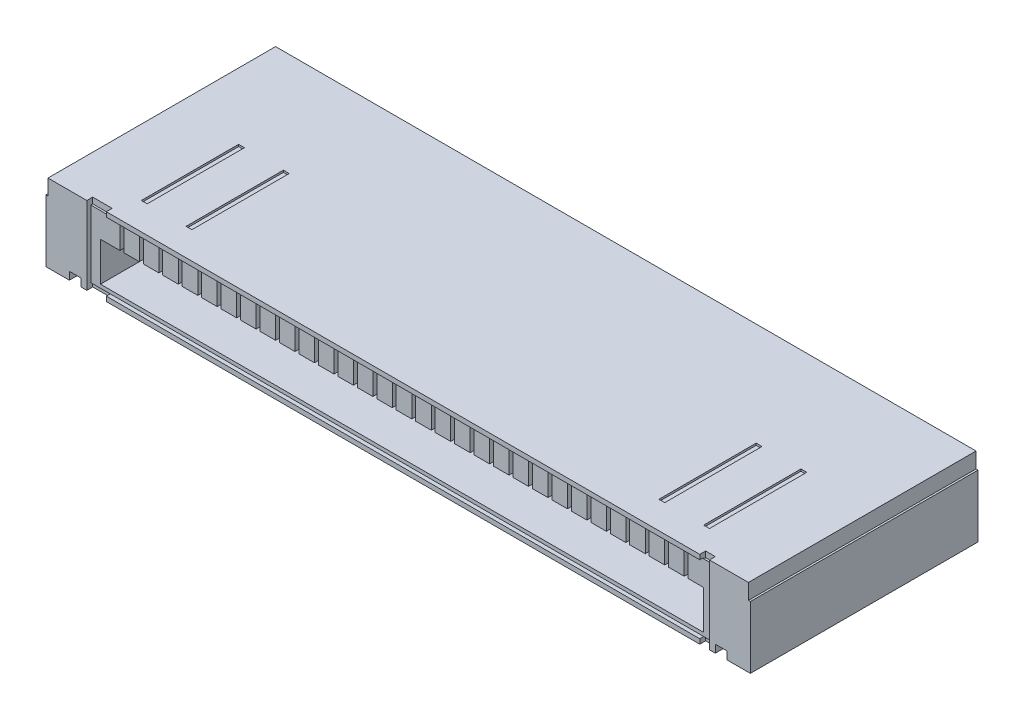
from build123d import *

# Parameters (mm, degrees)
BOSS_EXTRU_1_DEPTH       = 9
ENL_V_MAT_EXTRU_1_DEPTH  = 0.15
BOSS_EXTRU_2_DEPTH       = 6
CONG_1_R                 = 0.3
CONG_2_R                 = 0.3
ESQUISSE5_W              = 0.15
ESQUISSE5_H              = 2.5
ENL_V_MAT_EXTRU_2_DEPTH  = 0.05
ESQUISSE6_W              = 16
ESQUISSE6_H              = 1.75692954
ENL_V_MAT_EXTRU_3_DEPTH  = 0.1
ESQUISSE7_W              = 15.5
ESQUISSE7_H              = 1
ENL_V_MAT_EXTRU_4_DEPTH  = 4
ESQUISSE9_W              = 0.1
ESQUISSE9_H              = 0.66610296
ENL_V_MAT_EXTRU_5_DEPTH  = 0.1
ESQUISSE10_W             = 0.1
ESQUISSE10_H             = 3.9
ENL_V_MAT_EXTRU_6_DEPTH  = 0.1
ESQUISSE20_W             = 0.5
ESQUISSE20_H             = 0.15
ESQUISSE20_W_2           = 0.25
ENL_V_MAT_EXTRU_13_DEPTH = 0.15
ESQUISSE21_W             = 0.15
ESQUISSE21_H             = 2.5
ENL_V_MAT_EXTRU_14_DEPTH = 0.05
ESQUISSE22_W             = 0.3
ESQUISSE22_H             = 3
ENL_V_MAT_EXTRU_15_DEPTH = 0.2
SKETCH1_W                = 28.41764625
SKETCH1_H                = 6.211992325
CUT_EXTRUDE1_DEPTH       = 9
SKETCH2_W                = 0.5
SKETCH2_H                = 0.15
SKETCH2_W_2              = 0.25
CUT_EXTRUDE2_DEPTH       = 0.12154
CUT_EXTRUDE5_DEPTH       = 43.075134299


with BuildPart() as part:
    # Esquisse1 → Boss.-Extru.1 (new body)
    with BuildSketch(Plane.XY):
        with BuildLine():
            Line((-42.154464662, 2.5), (-21.154464662, 2.5))
            ThreePointArc((-21.154464662, 2.5), (-18.654464662, 0), (-21.154464662, -2.5))
            Line((-21.154464662, -2.5), (-42.154464662, -2.5))
            ThreePointArc((-42.154464662, -2.5), (-44.654464662, 0), (-42.154464662, 2.5))
        make_face()
    extrude(amount=BOSS_EXTRU_1_DEPTH)

    # Esquisse3 → Enlèv. mat.-Extru.1 (cut)
    with BuildSketch(Plane.XY.offset(9)):
        with BuildLine():
            Line((-42.141546062, 2), (-21.141546062, 2))
            ThreePointArc((-21.141546062, 2), (-19.141546062, 0), (-21.141546062, -2))
            Line((-21.141546062, -2), (-42.141546062, -2))
            ThreePointArc((-42.141546062, -2), (-44.141546062, 0), (-42.141546062, 2))
        make_face()
    extrude(amount=-ENL_V_MAT_EXTRU_1_DEPTH, mode=Mode.SUBTRACT)

    # Esquisse4 → Boss.-Extru.2 (add)
    with BuildSketch(Plane.XY.offset(8.85)):
        Polygon((-41.654464662, 0.5), (-40.654464662, 0.5), (-40.654464662, 1), (-22.654464662, 1), (-22.654464662, 0.5), (-21.654464662, 0.5), (-21.654464662, -1), (-41.654464662, -1), align=None)
    extrude(amount=BOSS_EXTRU_2_DEPTH)

    # Congé1
    cong_1_edges = [part.edges().sort_by_distance(p)[0] for p in [
        (-40.654464662, 0.5, 11.85),
    ]]
    fillet(cong_1_edges, radius=CONG_1_R)

    # Congé2
    cong_2_edges = [part.edges().sort_by_distance(p)[0] for p in [
        (-22.654464662, 0.5, 11.85),
    ]]
    fillet(cong_2_edges, radius=CONG_2_R)

    # Esquisse5 → Enlèv. mat.-Extru.2 (cut)
    with BuildSketch(Plane(origin=(0, 1, 0), x_dir=(1, 0, 0), z_dir=(0, 1, 0))):
        with Locations((-25.579464662, -12.9)):
            Rectangle(ESQUISSE5_W, ESQUISSE5_H)
        with Locations((-38.879464662, -12.9)):
            Rectangle(ESQUISSE5_W, ESQUISSE5_H)
        with Locations((-37.729464662, -12.9)):
            Rectangle(ESQUISSE5_W, ESQUISSE5_H)
        with Locations((-24.429464662, -12.9)):
            Rectangle(ESQUISSE5_W, ESQUISSE5_H)
    extrude(amount=-ENL_V_MAT_EXTRU_2_DEPTH, mode=Mode.SUBTRACT)

    # Esquisse6 → Enlèv. mat.-Extru.3 (cut)
    with BuildSketch(Plane.XY.offset(14.85)):
        with Locations((-31.654464662, 0)):
            Rectangle(ESQUISSE6_W, ESQUISSE6_H)
    extrude(amount=-ENL_V_MAT_EXTRU_3_DEPTH, mode=Mode.SUBTRACT)

    # Esquisse7 → Enlèv. mat.-Extru.4 (cut)
    with BuildSketch(Plane.XY.offset(14.75)):
        with Locations((-31.654464662, -0.28763819)):
            Rectangle(ESQUISSE7_W, ESQUISSE7_H)
    extrude(amount=-ENL_V_MAT_EXTRU_4_DEPTH, mode=Mode.SUBTRACT)

    # Esquisse9 → Enlèv. mat.-Extru.5 (cut)
    with BuildSketch(Plane.XY.offset(14.75)):
        with Locations((-38.854464662, 0.54541329)):
            Rectangle(ESQUISSE9_W, ESQUISSE9_H)
        with Locations((-38.354464662, 0.54541329)):
            Rectangle(ESQUISSE9_W, ESQUISSE9_H)
        with Locations((-37.854464662, 0.54541329)):
            Rectangle(ESQUISSE9_W, ESQUISSE9_H)
        with Locations((-37.354464662, 0.54541329)):
            Rectangle(ESQUISSE9_W, ESQUISSE9_H)
        with Locations((-36.854464662, 0.54541329)):
            Rectangle(ESQUISSE9_W, ESQUISSE9_H)
        with Locations((-36.354464662, 0.54541329)):
            Rectangle(ESQUISSE9_W, ESQUISSE9_H)
        with Locations((-35.854464662, 0.54541329)):
            Rectangle(ESQUISSE9_W, ESQUISSE9_H)
        with Locations((-35.354464662, 0.54541329)):
            Rectangle(ESQUISSE9_W, ESQUISSE9_H)
        with Locations((-34.854464662, 0.54541329)):
            Rectangle(ESQUISSE9_W, ESQUISSE9_H)
        with Locations((-34.354464662, 0.54541329)):
            Rectangle(ESQUISSE9_W, ESQUISSE9_H)
        with Locations((-33.854464662, 0.54541329)):
            Rectangle(ESQUISSE9_W, ESQUISSE9_H)
        with Locations((-33.354464662, 0.54541329)):
            Rectangle(ESQUISSE9_W, ESQUISSE9_H)
        with Locations((-32.854464662, 0.54541329)):
            Rectangle(ESQUISSE9_W, ESQUISSE9_H)
        with Locations((-32.354464662, 0.54541329)):
            Rectangle(ESQUISSE9_W, ESQUISSE9_H)
        with Locations((-31.854464662, 0.54541329)):
            Rectangle(ESQUISSE9_W, ESQUISSE9_H)
        with Locations((-31.354464662, 0.54541329)):
            Rectangle(ESQUISSE9_W, ESQUISSE9_H)
        with Locations((-30.854464662, 0.54541329)):
            Rectangle(ESQUISSE9_W, ESQUISSE9_H)
        with Locations((-30.354464662, 0.54541329)):
            Rectangle(ESQUISSE9_W, ESQUISSE9_H)
        with Locations((-29.854464662, 0.54541329)):
            Rectangle(ESQUISSE9_W, ESQUISSE9_H)
        with Locations((-29.354464662, 0.54541329)):
            Rectangle(ESQUISSE9_W, ESQUISSE9_H)
        with Locations((-28.854464662, 0.54541329)):
            Rectangle(ESQUISSE9_W, ESQUISSE9_H)
        with Locations((-28.354464662, 0.54541329)):
            Rectangle(ESQUISSE9_W, ESQUISSE9_H)
        with Locations((-27.854464662, 0.54541329)):
            Rectangle(ESQUISSE9_W, ESQUISSE9_H)
        with Locations((-27.354464662, 0.54541329)):
            Rectangle(ESQUISSE9_W, ESQUISSE9_H)
        with Locations((-26.854464662, 0.54541329)):
            Rectangle(ESQUISSE9_W, ESQUISSE9_H)
        with Locations((-26.354464662, 0.54541329)):
            Rectangle(ESQUISSE9_W, ESQUISSE9_H)
        with Locations((-25.854464662, 0.54541329)):
            Rectangle(ESQUISSE9_W, ESQUISSE9_H)
        with Locations((-25.354464662, 0.54541329)):
            Rectangle(ESQUISSE9_W, ESQUISSE9_H)
        with Locations((-24.854464662, 0.54541329)):
            Rectangle(ESQUISSE9_W, ESQUISSE9_H)
        with Locations((-24.354464662, 0.54541329)):
            Rectangle(ESQUISSE9_W, ESQUISSE9_H)
    extrude(amount=-ENL_V_MAT_EXTRU_5_DEPTH, mode=Mode.SUBTRACT)

    # Esquisse10 → Enlèv. mat.-Extru.6 (cut)
    with BuildSketch(Plane.XZ.offset(-0.21236181)):
        with Locations((-38.854464662, 12.7)):
            Rectangle(ESQUISSE10_W, ESQUISSE10_H)
        with Locations((-38.354464662, 12.7)):
            Rectangle(ESQUISSE10_W, ESQUISSE10_H)
        with Locations((-37.854464662, 12.7)):
            Rectangle(ESQUISSE10_W, ESQUISSE10_H)
        with Locations((-37.354464662, 12.7)):
            Rectangle(ESQUISSE10_W, ESQUISSE10_H)
        with Locations((-36.854464662, 12.7)):
            Rectangle(ESQUISSE10_W, ESQUISSE10_H)
        with Locations((-36.354464662, 12.7)):
            Rectangle(ESQUISSE10_W, ESQUISSE10_H)
        with Locations((-35.854464662, 12.7)):
            Rectangle(ESQUISSE10_W, ESQUISSE10_H)
        with Locations((-35.354464662, 12.7)):
            Rectangle(ESQUISSE10_W, ESQUISSE10_H)
        with Locations((-34.854464662, 12.7)):
            Rectangle(ESQUISSE10_W, ESQUISSE10_H)
        with Locations((-34.354464662, 12.7)):
            Rectangle(ESQUISSE10_W, ESQUISSE10_H)
        with Locations((-33.854464662, 12.7)):
            Rectangle(ESQUISSE10_W, ESQUISSE10_H)
        with Locations((-33.354464662, 12.7)):
            Rectangle(ESQUISSE10_W, ESQUISSE10_H)
        with Locations((-32.854464662, 12.7)):
            Rectangle(ESQUISSE10_W, ESQUISSE10_H)
        with Locations((-32.354464662, 12.7)):
            Rectangle(ESQUISSE10_W, ESQUISSE10_H)
        with Locations((-31.854464662, 12.7)):
            Rectangle(ESQUISSE10_W, ESQUISSE10_H)
        with Locations((-31.354464662, 12.7)):
            Rectangle(ESQUISSE10_W, ESQUISSE10_H)
        with Locations((-30.854464662, 12.7)):
            Rectangle(ESQUISSE10_W, ESQUISSE10_H)
        with Locations((-30.354464662, 12.7)):
            Rectangle(ESQUISSE10_W, ESQUISSE10_H)
        with Locations((-29.854464662, 12.7)):
            Rectangle(ESQUISSE10_W, ESQUISSE10_H)
        with Locations((-29.354464662, 12.7)):
            Rectangle(ESQUISSE10_W, ESQUISSE10_H)
        with Locations((-28.854464662, 12.7)):
            Rectangle(ESQUISSE10_W, ESQUISSE10_H)
        with Locations((-28.354464662, 12.7)):
            Rectangle(ESQUISSE10_W, ESQUISSE10_H)
        with Locations((-27.854464662, 12.7)):
            Rectangle(ESQUISSE10_W, ESQUISSE10_H)
        with Locations((-27.354464662, 12.7)):
            Rectangle(ESQUISSE10_W, ESQUISSE10_H)
        with Locations((-26.854464662, 12.7)):
            Rectangle(ESQUISSE10_W, ESQUISSE10_H)
        with Locations((-26.354464662, 12.7)):
            Rectangle(ESQUISSE10_W, ESQUISSE10_H)
        with Locations((-25.854464662, 12.7)):
            Rectangle(ESQUISSE10_W, ESQUISSE10_H)
        with Locations((-25.354464662, 12.7)):
            Rectangle(ESQUISSE10_W, ESQUISSE10_H)
        with Locations((-24.854464662, 12.7)):
            Rectangle(ESQUISSE10_W, ESQUISSE10_H)
        with Locations((-24.354464662, 12.7)):
            Rectangle(ESQUISSE10_W, ESQUISSE10_H)
    extrude(amount=-ENL_V_MAT_EXTRU_6_DEPTH, mode=Mode.SUBTRACT)

    # Esquisse20 → Enlèv. mat.-Extru.13 (cut)
    with BuildSketch(Plane(origin=(0, 1, 0), x_dir=(1, 0, 0), z_dir=(0, 1, 0))):
        with Locations((-39.404464662, -14.775)):
            Rectangle(ESQUISSE20_W, ESQUISSE20_H)
        with Locations((-23.779464662, -14.775)):
            Rectangle(ESQUISSE20_W_2, ESQUISSE20_H)
    extrude(amount=-ENL_V_MAT_EXTRU_13_DEPTH, mode=Mode.SUBTRACT)

    # Esquisse21 → Enlèv. mat.-Extru.14 (cut)
    with BuildSketch(Plane.XZ.offset(1)):
        with Locations((-25.579464662, 12.9)):
            Rectangle(ESQUISSE21_W, ESQUISSE21_H)
        with Locations((-38.879464662, 12.9)):
            Rectangle(ESQUISSE21_W, ESQUISSE21_H)
        with Locations((-37.729464662, 12.9)):
            Rectangle(ESQUISSE21_W, ESQUISSE21_H)
        with Locations((-24.429464662, 12.9)):
            Rectangle(ESQUISSE21_W, ESQUISSE21_H)
    extrude(amount=-ENL_V_MAT_EXTRU_14_DEPTH, mode=Mode.SUBTRACT)

    # Esquisse22 → Enlèv. mat.-Extru.15 (cut)
    with BuildSketch(Plane.XZ.offset(1)):
        with Locations((-39.954464662, 13.35)):
            Rectangle(ESQUISSE22_W, ESQUISSE22_H)
        with Locations((-23.354464662, 13.35)):
            Rectangle(ESQUISSE22_W, ESQUISSE22_H)
    extrude(amount=-ENL_V_MAT_EXTRU_15_DEPTH, mode=Mode.SUBTRACT)

    # Sketch1 → Cut-Extrude1 (cut)
    with BuildSketch(Plane.XY):
        with Locations((-31.72011797, -0.327414657)):
            Rectangle(SKETCH1_W, SKETCH1_H)
    extrude(amount=CUT_EXTRUDE1_DEPTH, mode=Mode.SUBTRACT)

    # Sketch2 → Cut-Extrude2 (cut)
    with BuildSketch(Plane.XZ.offset(1)):
        with Locations((-39.404464662, 14.775)):
            Rectangle(SKETCH2_W, SKETCH2_H)
        with Locations((-23.779464662, 14.775)):
            Rectangle(SKETCH2_W_2, SKETCH2_H)
    extrude(amount=-CUT_EXTRUDE2_DEPTH, mode=Mode.SUBTRACT)

    # Sketch3 → Cut-Extrude5 (cut, through all)
    with BuildSketch(Plane(origin=(0, 0, 9), x_dir=(-1, 0, 0), z_dir=(0, 0, -1))):
        Polygon((22.604464662, 0.6), (22.604464662, -1), (21.654464662, -1), (21.654464662, 1), (22.654464662, 1), (22.654464662, 0.6), align=None)
        Polygon((41.654464662, -1), (40.704464662, -1), (40.704464662, 0.6), (40.654464662, 0.6), (40.654464662, 1), (41.654464662, 1), align=None)
    extrude(amount=-CUT_EXTRUDE5_DEPTH, mode=Mode.SUBTRACT)


solid = part.part
